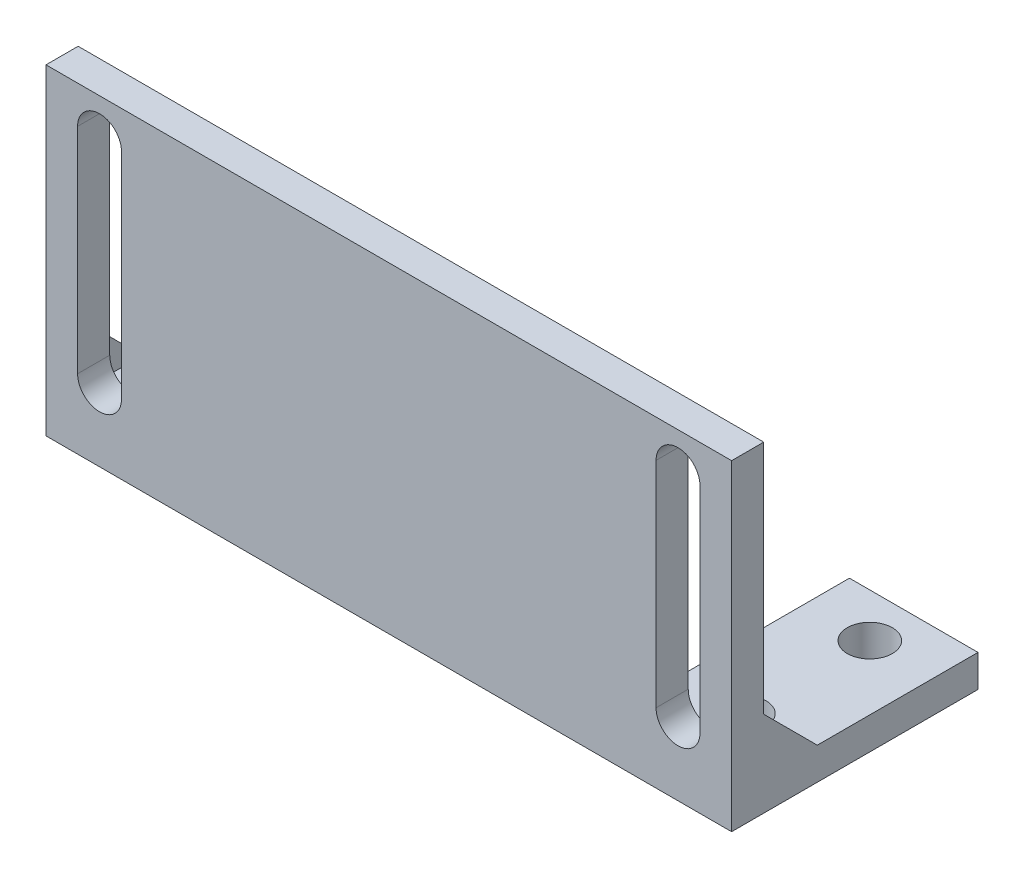
from build123d import *

# Parameters (mm, degrees)
BOSS_EXTRUDE1_DEPTH = 3
SKETCH2_R           = 2.1
CUT_EXTRUDE1_DEPTH  = 3
BOSS_EXTRUDE2_DEPTH = 27
CUT_EXTRUDE2_DEPTH  = 27
RIB1_REACH          = 75.171
SKETCH5_WALL_W      = 155.413132852
SKETCH5_WALL_H      = 1
RIB2_REACH          = 75.171
SKETCH6_WALL_W      = 155.413132852
SKETCH6_WALL_H      = 1


with BuildPart() as part:
    # Sketch1 → Boss-Extrude1 (new body)
    with BuildSketch(Plane(origin=(0, 0, 0), x_dir=(1, 0, 0), z_dir=(0, 1, 0))):
        Polygon((0, 0), (0, 23), (12, 23), (12, 3), (52, 3), (52, 23), (64, 23), (64, 0), align=None)
    extrude(amount=-BOSS_EXTRUDE1_DEPTH)

    # Sketch2 → Cut-Extrude1 (cut)
    with BuildSketch(Plane(origin=(0, -3, 0), x_dir=(-1, 0, 0), z_dir=(0, -1, 0))):
        with Locations(Location((-6, 18.9, 0), (0, 0, 90))):
            Circle(SKETCH2_R)
        with Locations(Location((-6, 7.1, 0), (0, 0, 90))):
            Circle(SKETCH2_R)
        with Locations(Location((-58, 7.1, 0), (0, 0, 270))):
            Circle(SKETCH2_R)
        with Locations(Location((-58, 18.9, 0), (0, 0, 270))):
            Circle(SKETCH2_R)
    extrude(amount=-CUT_EXTRUDE1_DEPTH, mode=Mode.SUBTRACT)

    # Sketch3 → Boss-Extrude2 (add)
    with BuildSketch(Plane(origin=(0, 0, 0), x_dir=(1, 0, 0), z_dir=(0, 1, 0))):
        Polygon((52, 3), (12, 3), (0, 3), (0, 0), (64, 0), (64, 3), align=None)
    extrude(amount=BOSS_EXTRUDE2_DEPTH)

    # Sketch4 → Cut-Extrude2 (cut)
    with BuildSketch(Plane(origin=(0, 0, -3), x_dir=(-1, 0, 0), z_dir=(0, 0, -1))):
        with BuildLine():
            Line((-56.95, 23.5), (-56.95, 3.5))
            ThreePointArc((-56.95, 3.5), (-59, 1.45), (-61.05, 3.5))
            Line((-61.05, 3.5), (-61.05, 23.5))
            ThreePointArc((-61.05, 23.5), (-59, 25.55), (-56.95, 23.5))
        make_face()
        with BuildLine():
            Line((-7.05, 23.5), (-7.05, 3.5))
            ThreePointArc((-7.05, 3.5), (-5, 1.45), (-2.95, 3.5))
            Line((-2.95, 3.5), (-2.95, 23.5))
            ThreePointArc((-2.95, 23.5), (-5, 25.55), (-7.05, 23.5))
        make_face()
    extrude(amount=-CUT_EXTRUDE2_DEPTH, mode=Mode.SUBTRACT)

    # Sketch5 wall → Rib1 (add, up to next)
    with BuildSketch(Plane(origin=(64, 2.5, -5.5), x_dir=(0, -0.707106781187, -0.707106781187), z_dir=(0, 0.707106781187, -0.707106781187)), mode=Mode.PRIVATE) as rib1_sk1:
        with Locations((0, 0.5)):
            Rectangle(SKETCH5_WALL_W, SKETCH5_WALL_H)
    rib1_tool1 = extrude(rib1_sk1.sketch, amount=-RIB1_REACH, mode=Mode.PRIVATE) - part.part
    add(rib1_tool1.solids().sort_by_distance((64, 2.5, -5.5))[0])

    # Sketch6 wall → Rib2 (add, up to next)
    with BuildSketch(Plane(origin=(0, 2.5, -5.5), x_dir=(0, -0.707106781187, -0.707106781187), z_dir=(0, 0.707106781187, -0.707106781187)), mode=Mode.PRIVATE) as rib2_sk1:
        with Locations((0, -0.5)):
            Rectangle(SKETCH6_WALL_W, SKETCH6_WALL_H)
    rib2_tool1 = extrude(rib2_sk1.sketch, amount=-RIB2_REACH, mode=Mode.PRIVATE) - part.part
    add(rib2_tool1.solids().sort_by_distance((0, 2.5, -5.5))[0])


solid = part.part
